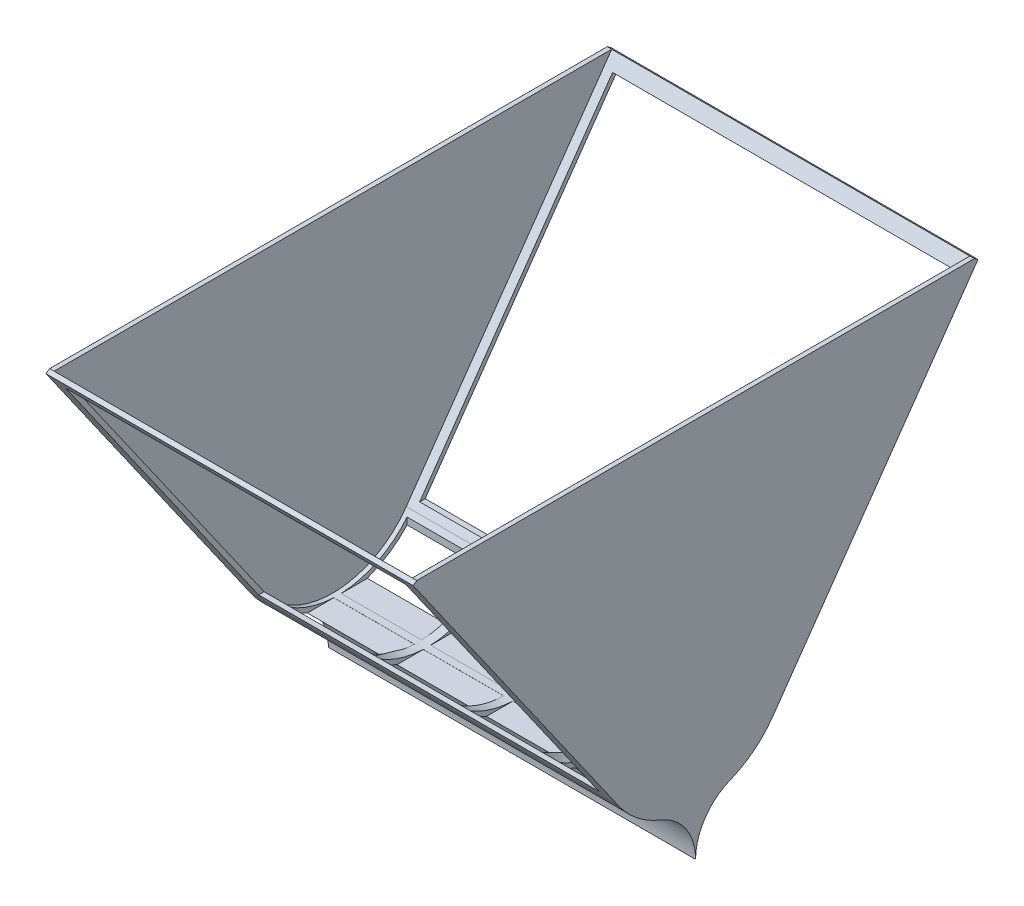
from build123d import *

# Parameters (mm, degrees)
BOSS_EXTRUDE1_DEPTH     = 80
CUT_EXTRUDE1_DEPTH      = 116.337274212
CUT_EXTRUDE1_DEPTH_BACK = 116.337274212
SKETCH2_W               = 76
SKETCH2_H               = 61.532163543
SKETCH3_W               = 18
SKETCH3_H               = 14.744736797
CUT_EXTRUDE2_DEPTH      = 20
BOSS_EXTRUDE2_DEPTH     = 1
BOSS_EXTRUDE3_START     = -81
BOSS_EXTRUDE3_DEPTH     = 1


with BuildPart() as part:
    # Sketch1 → Boss-Extrude1 (new body)
    with BuildSketch(Plane(origin=(0, 0, 0), x_dir=(0, 0, -1), z_dir=(1, 0, 0))):
        with BuildLine():
            Line((-17.20219293, -12.045105163), (-63.088307838, 53.48705838))
            Line((-63.088307838, 53.48705838), (-62.269155794, 54.060634816))
            Line((-62.269155794, 54.060634816), (-16.383040886, -11.471528727))
            ThreePointArc((-16.383040886, -11.471528727), (0, -20), (16.383040886, -11.471528727))
            Line((16.383040886, -11.471528727), (62.269155794, 54.060634816))
            Line((62.269155794, 54.060634816), (63.088307838, 53.48705838))
            Line((63.088307838, 53.48705838), (17.20219293, -12.045105163))
            ThreePointArc((17.20219293, -12.045105163), (0, -21), (-17.20219293, -12.045105163))
        make_face()
        with BuildLine():
            ThreePointArc((7.788873039, -19.5021398), (0, -21), (-7.788873039, -19.5021398))
            ThreePointArc((-7.788873039, -19.5021398), (-2.130530499, -24.056165822), (0, -31))
            ThreePointArc((0, -31), (2.130530499, -24.056165822), (7.788873039, -19.5021398))
        make_face()
    extrude(amount=BOSS_EXTRUDE1_DEPTH)

    # Sketch2 → Cut-Extrude1 (cut, two sides: drawn at the far end of the back side and taken through both)
    with BuildSketch(Plane.XY.offset(-CUT_EXTRUDE1_DEPTH_BACK)):
        with Locations((40, 20.720976608)):
            Rectangle(SKETCH2_W, SKETCH2_H)
    extrude(amount=CUT_EXTRUDE1_DEPTH + CUT_EXTRUDE1_DEPTH_BACK, mode=Mode.SUBTRACT)

    # Sketch3 → Cut-Extrude2 (cut)
    with BuildSketch(Plane(origin=(0, 0, 0), x_dir=(1, 0, 0), z_dir=(0, 1, 0))):
        with Locations((10, -8.191520442)):
            Rectangle(SKETCH3_W, SKETCH3_H)
        with Locations((10, 8.191520442)):
            Rectangle(SKETCH3_W, SKETCH3_H)
        with Locations((30, 8.191520442)):
            Rectangle(SKETCH3_W, SKETCH3_H)
        with Locations((30, -8.191520442)):
            Rectangle(SKETCH3_W, SKETCH3_H)
        with Locations((50, -8.191520442)):
            Rectangle(SKETCH3_W, SKETCH3_H)
        with Locations((50, 8.191520442)):
            Rectangle(SKETCH3_W, SKETCH3_H)
        with Locations((70, -8.191520442)):
            Rectangle(SKETCH3_W, SKETCH3_H)
        with Locations((70, 8.191520442)):
            Rectangle(SKETCH3_W, SKETCH3_H)
    extrude(amount=-CUT_EXTRUDE2_DEPTH, mode=Mode.SUBTRACT)

    # Sketch4 → Boss-Extrude2 (add)
    with BuildSketch(Plane(origin=(80, 0, 0), x_dir=(0, 0, -1), z_dir=(1, 0, 0))):
        with BuildLine():
            Line((-62.269155794, 54.060634816), (62.269155794, 54.060634816))
            Line((62.269155794, 54.060634816), (16.383040886, -11.471528727))
            ThreePointArc((16.383040886, -11.471528727), (0, -20), (-16.383040886, -11.471528727))
            Line((-16.383040886, -11.471528727), (-62.269155794, 54.060634816))
        make_face()
        with BuildLine():
            Line((-62.269155794, 54.060634816), (-63.088307838, 53.48705838))
            Line((-63.088307838, 53.48705838), (-17.20219293, -12.045105163))
            ThreePointArc((-17.20219293, -12.045105163), (-13.03994578, -16.460857026), (-7.788873039, -19.5021398))
            ThreePointArc((-7.788873039, -19.5021398), (-2.130530499, -24.056165822), (0, -31))
            ThreePointArc((0, -31), (2.130530499, -24.056165822), (7.788873039, -19.5021398))
            ThreePointArc((7.788873039, -19.5021398), (13.03994578, -16.460857026), (17.20219293, -12.045105163))
            Line((17.20219293, -12.045105163), (63.088307838, 53.48705838))
            Line((63.088307838, 53.48705838), (62.269155794, 54.060634816))
            Line((62.269155794, 54.060634816), (16.383040886, -11.471528727))
            ThreePointArc((16.383040886, -11.471528727), (0, -20), (-16.383040886, -11.471528727))
            Line((-16.383040886, -11.471528727), (-62.269155794, 54.060634816))
        make_face()
    extrude(amount=BOSS_EXTRUDE2_DEPTH)

    # Sketch4<3> → Boss-Extrude3 (add)
    with BuildSketch(Plane(origin=(80, 0, 0), x_dir=(0, 0, -1), z_dir=(1, 0, 0)).offset(BOSS_EXTRUDE3_START)):
        with BuildLine():
            Line((-62.269155794, 54.060634816), (62.269155794, 54.060634816))
            Line((62.269155794, 54.060634816), (16.383040886, -11.471528727))
            ThreePointArc((16.383040886, -11.471528727), (0, -20), (-16.383040886, -11.471528727))
            Line((-16.383040886, -11.471528727), (-62.269155794, 54.060634816))
        make_face()
        with BuildLine():
            Line((-62.269155794, 54.060634816), (-63.088307838, 53.48705838))
            Line((-63.088307838, 53.48705838), (-17.20219293, -12.045105163))
            ThreePointArc((-17.20219293, -12.045105163), (-13.03994578, -16.460857026), (-7.788873039, -19.5021398))
            ThreePointArc((-7.788873039, -19.5021398), (-2.130530499, -24.056165822), (0, -31))
            ThreePointArc((0, -31), (2.130530499, -24.056165822), (7.788873039, -19.5021398))
            ThreePointArc((7.788873039, -19.5021398), (13.03994578, -16.460857026), (17.20219293, -12.045105163))
            Line((17.20219293, -12.045105163), (63.088307838, 53.48705838))
            Line((63.088307838, 53.48705838), (62.269155794, 54.060634816))
            Line((62.269155794, 54.060634816), (16.383040886, -11.471528727))
            ThreePointArc((16.383040886, -11.471528727), (0, -20), (-16.383040886, -11.471528727))
            Line((-16.383040886, -11.471528727), (-62.269155794, 54.060634816))
        make_face()
    extrude(amount=BOSS_EXTRUDE3_DEPTH)


solid = part.part
